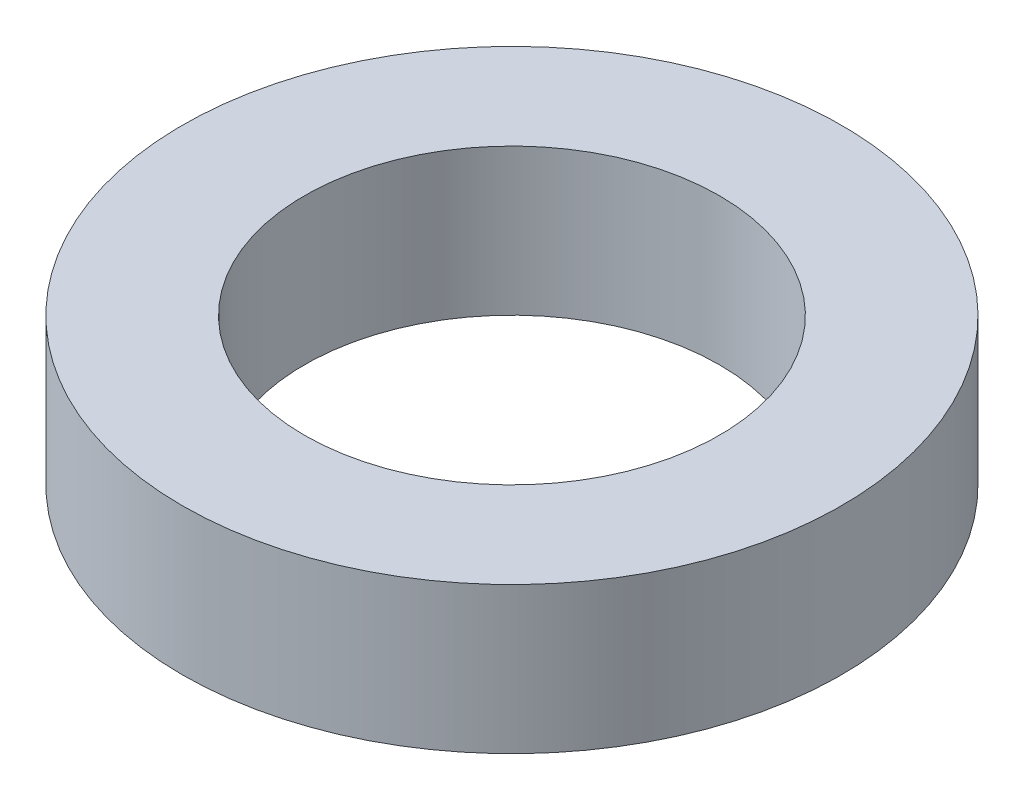
from build123d import *

# Parameters (mm, degrees)
SKETCH_1_R      = 27
SKETCH_1_R_2    = 17
EXTRUDE_1_DEPTH = 12


with BuildPart() as part:
    # 草图1 → 凸台-拉伸1 (new body)
    with BuildSketch(Plane(origin=(0, 0, 0), x_dir=(1, 0, 0), z_dir=(0, 1, 0))):
        with Locations(Location((0, 0, 0), (0, 0, 270))):
            Circle(SKETCH_1_R)
        with Locations(Location((0, 0, 0), (0, 0, 270))):
            Circle(SKETCH_1_R_2, mode=Mode.SUBTRACT)
    extrude(amount=EXTRUDE_1_DEPTH)


solid = part.part
